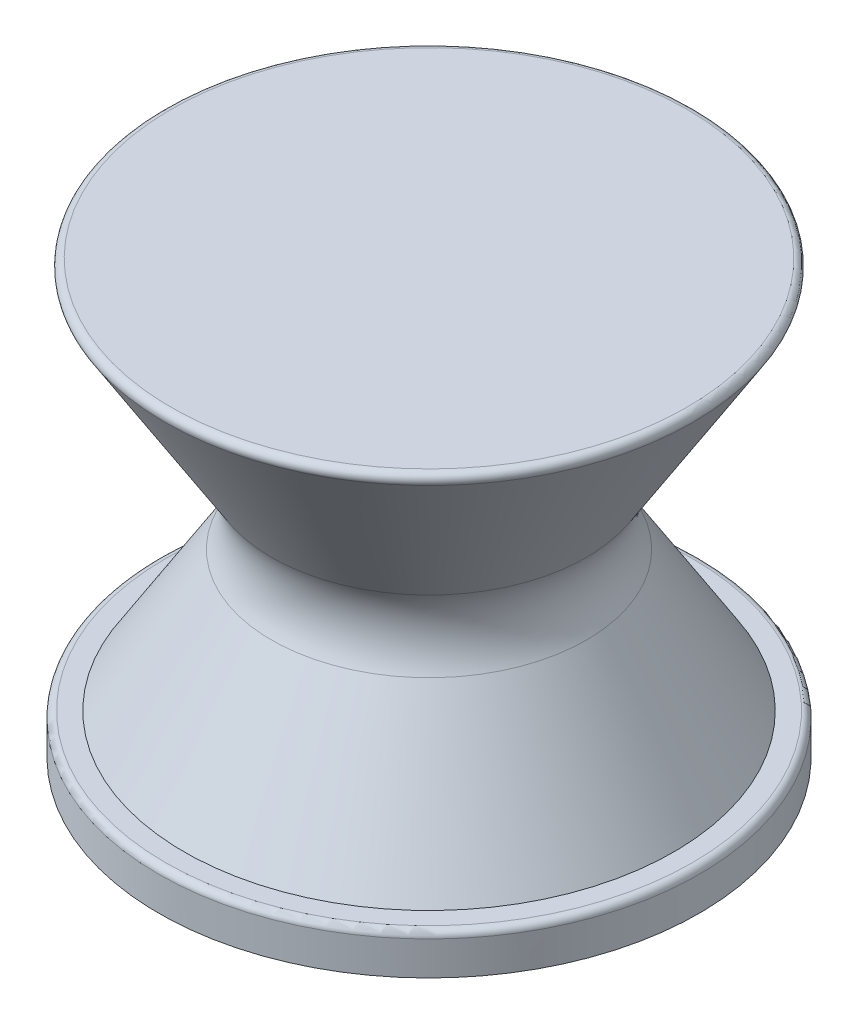
from build123d import *

# Parameters (mm, degrees)
FILLET1_R = 5
FILLET2_R = 0.5
FILLET3_R = 0.5


with BuildPart() as part:
    # Sketch1 → Revolve1 (revolve)
    with BuildSketch(Plane(origin=(0, 0, 0), x_dir=(0, 0, -1), z_dir=(1, 0, 0))):
        Polygon((20, 0), (0, 0), (0, 32), (20, 32), (10, 16), align=None)
        Polygon((18.125, 3), (20, 0), (20, 3), align=None)
    revolve(axis=Axis((0, 0, 0), (0, 1, 0)))

    # Fillet1
    fillet1_edges = [part.edges().sort_by_distance(p)[0] for p in [
        (0, 16, 10),
    ]]
    fillet(fillet1_edges, radius=FILLET1_R)

    # Fillet2
    fillet2_edges = [part.edges().sort_by_distance(p)[0] for p in [
        (0, 32, 20),
    ]]
    fillet(fillet2_edges, radius=FILLET2_R)

    # Fillet3
    fillet3_edges = [part.edges().sort_by_distance(p)[0] for p in [
        (0, 3, 20),
    ]]
    fillet(fillet3_edges, radius=FILLET3_R)


solid = part.part
